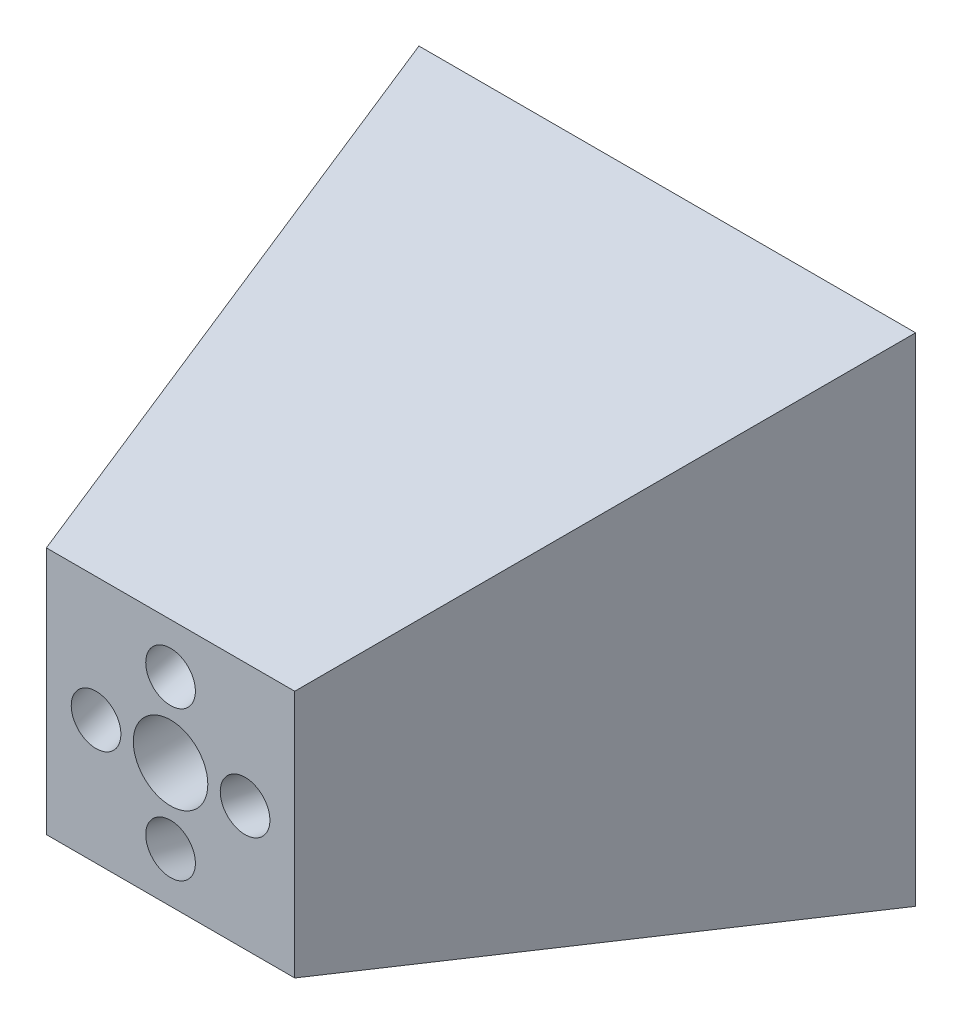
from build123d import *

# Parameters (mm, degrees)
SKETCH13_R        = 7500
SKETCH14_R        = 5000
CIRPATTERN1_COUNT = 4


with BuildPart() as part:
    # Sketch1 → Loft1 section 0
    with BuildSketch(Plane.XY):
        with BuildLine():
            Line((-25000, 25000), (25000, 25000))
            Line((25000, 25000), (25000, -25000))
            Line((25000, -25000), (-25000, -25000))
            Line((-25000, -25000), (-25000, 25000))
        make_face()
    # Sketch2 → Loft1 section 1
    with BuildSketch(Plane.XY.offset(-100000)):
        with BuildLine():
            Line((-50000, -50000), (50000, -50000))
            Line((50000, -50000), (50000, 50000))
            Line((50000, 50000), (-50000, 50000))
            Line((-50000, 50000), (-50000, -50000))
        make_face()
    loft()

    # Cut-Sweep1: sweep along a path in Sketch12
    with BuildLine(Plane(origin=(0, 0, 0), x_dir=(1, 0, 0), z_dir=(0, 1, 0))) as cut_sweep1_path:
        Line((0, 100000), (0, 0))
    # Sketch13 → Cut-Sweep1 (sweep, cut)
    with BuildSketch(Plane(origin=(0, 0, -100000), x_dir=(-1, 0, 0), z_dir=(0, 0, -1))):
        Circle(SKETCH13_R)
    sweep(path=cut_sweep1_path.line, mode=Mode.SUBTRACT)

    # Cut-Sweep2: sweep along a path in Sketch17
    with BuildLine(Plane(origin=(0, 0, 0), x_dir=(0, 0, -1), z_dir=(1, 0, 0))) as cut_sweep2_path:
        Line((100000, 40000), (0, 15000))
    # Sketch14 → Cut-Sweep2 (sweep, cut)
    with BuildSketch(Plane(origin=(0, 0, -100000), x_dir=(-1, 0, 0), z_dir=(0, 0, -1))):
        with Locations((0, 40000)):
            Circle(SKETCH14_R)
    cut_sweep2 = sweep(path=cut_sweep2_path.line, mode=Mode.SUBTRACT)

    # CirPattern1: Cut-Sweep2 ×4 about axis
    cirpattern1_axis = Axis((0, 0, -101000), (0, 0, 1))
    for i in range(1, CIRPATTERN1_COUNT):
        add(cut_sweep2.rotate(cirpattern1_axis, i * 360 / CIRPATTERN1_COUNT), mode=Mode.SUBTRACT)


solid = part.part
